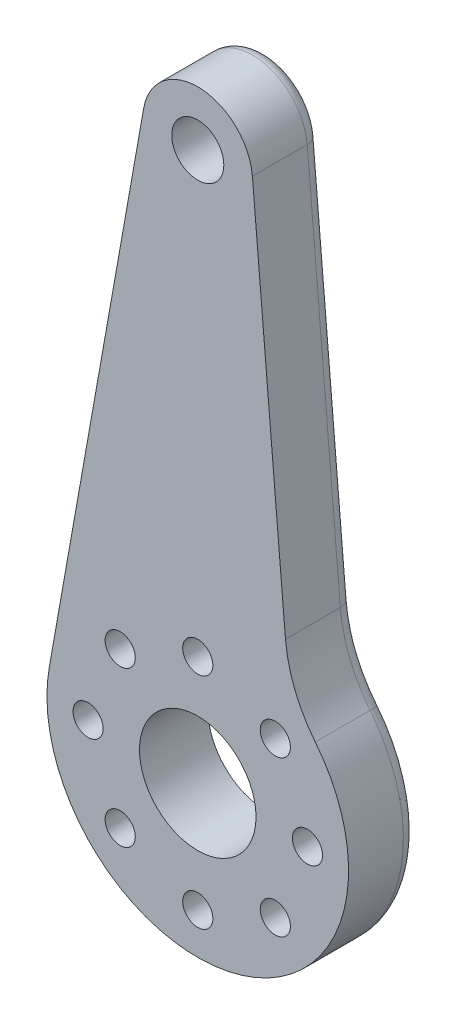
from build123d import *
from build123d.topology import SkipClean

# Parameters (mm, degrees)
SKETCH1_R             = 1.9
SKETCH1_R_2           = 4.25
SKETCH1_R_3           = 1.1
BOSS_EXTRUDE1_DEPTH   = 5
SKETCH4_R             = 1.75
CUT_EXTRUDE3_DEPTH    = 2.25
CORTAR_EXTRUIR1_DEPTH = 10
REDONDEO1_R           = 10
REDONDEO2_R           = 1


with BuildPart() as part:
    # Sketch1 → Boss-Extrude1 (new body)
    with BuildSketch(Plane.XY):
        with BuildLine():
            Line((-18.926637777, 20.351096398), (-25.818616811, -18.423903602))
            ThreePointArc((-25.818616811, -18.423903602), (-14.988364044, -31.348903602), (-4.158111277, -18.423903602))
            Line((-4.158111277, -18.423903602), (-11.05009031, 20.351096398))
            ThreePointArc((-11.05009031, 20.351096398), (-14.988364044, 23.651096398), (-18.926637777, 20.351096398))
        make_face()
        with Locations((-14.988364044, 19.651096398)):
            Circle(SKETCH1_R, mode=Mode.SUBTRACT)
        with Locations((-14.988364044, -20.348903602)):
            Circle(SKETCH1_R_2, mode=Mode.SUBTRACT)
        with Locations((-6.988364044, -20.348903602)):
            Circle(SKETCH1_R_3, mode=Mode.SUBTRACT)
        with Locations((-9.331509794, -26.005757851)):
            Circle(SKETCH1_R_3, mode=Mode.SUBTRACT)
        with Locations((-14.988364044, -28.348903602)):
            Circle(SKETCH1_R_3, mode=Mode.SUBTRACT)
        with Locations((-20.645218293, -26.005757851)):
            Circle(SKETCH1_R_3, mode=Mode.SUBTRACT)
        with Locations((-22.988364044, -20.348903602)):
            Circle(SKETCH1_R_3, mode=Mode.SUBTRACT)
        with Locations((-20.645218293, -14.692049352)):
            Circle(SKETCH1_R_3, mode=Mode.SUBTRACT)
        with Locations((-14.988364044, -12.348903602)):
            Circle(SKETCH1_R_3, mode=Mode.SUBTRACT)
        with Locations((-9.331509794, -14.692049352)):
            Circle(SKETCH1_R_3, mode=Mode.SUBTRACT)
    extrude(amount=BOSS_EXTRUDE1_DEPTH)

    # Sketch4 → Cut-Extrude3 (cut)
    with BuildSketch(Plane(origin=(0, 0, 0), x_dir=(-1, 0, 0), z_dir=(0, 0, -1))):
        with Locations((22.988364044, -20.348903602)):
            Circle(SKETCH4_R)
        with Locations((20.645218293, -26.005757851)):
            Circle(SKETCH4_R)
        with Locations((14.988364044, -28.348903602)):
            Circle(SKETCH4_R)
        with Locations((9.331509794, -26.005757851)):
            Circle(SKETCH4_R)
        with Locations((6.988364044, -20.348903602)):
            Circle(SKETCH4_R)
        with Locations((9.331509794, -14.692049352)):
            Circle(SKETCH4_R)
        with Locations((14.988364044, -12.348903602)):
            Circle(SKETCH4_R)
        with Locations((20.645218293, -14.692049352)):
            Circle(SKETCH4_R)
    extrude(amount=-CUT_EXTRUDE3_DEPTH, mode=Mode.SUBTRACT)

    # Croquis1 → Cortar-Extruir1 (cut)
    with SkipClean():  # the faces are left unmerged after this step: merging them gives an invalid solid
        with BuildSketch(Plane(origin=(0, 0, 0), x_dir=(-1, 0, 0), z_dir=(0, 0, -1))):
            with BuildLine():
                Line((11.003110402, 19.994248567), (8.279982388, -11.631242473))
                ThreePointArc((8.279982388, -11.631242473), (5.584323122, -14.642414809), (4.158111277, -18.423903602))
                Line((4.158111277, -18.423903602), (11.05009031, 20.351096398))
                ThreePointArc((11.05009031, 20.351096398), (11.022584598, 20.173201167), (11.003110402, 19.994248567))
            make_face()
        extrude(amount=-CORTAR_EXTRUIR1_DEPTH, mode=Mode.SUBTRACT)

    # Redondeo1
    redondeo1_edges = [part.edges().sort_by_distance(p)[0] for p in [
        (-8.279982388, -11.631242473, 2.5),
    ]]
    fillet(redondeo1_edges, radius=REDONDEO1_R)

    # Redondeo2
    redondeo2_edges = [part.edges().sort_by_distance(p)[0] for p in [
        (-9.795996729, 5.975237179, 0),
        (-7.906176898, -10.910629635, 0),
        (-14.988364044, -31.348903602, 0),
        (-22.372627294, 0.963596398, 0),
        (-14.988364044, 23.651096398, 0),
    ]]
    fillet(redondeo2_edges, radius=REDONDEO2_R)


solid = part.part
